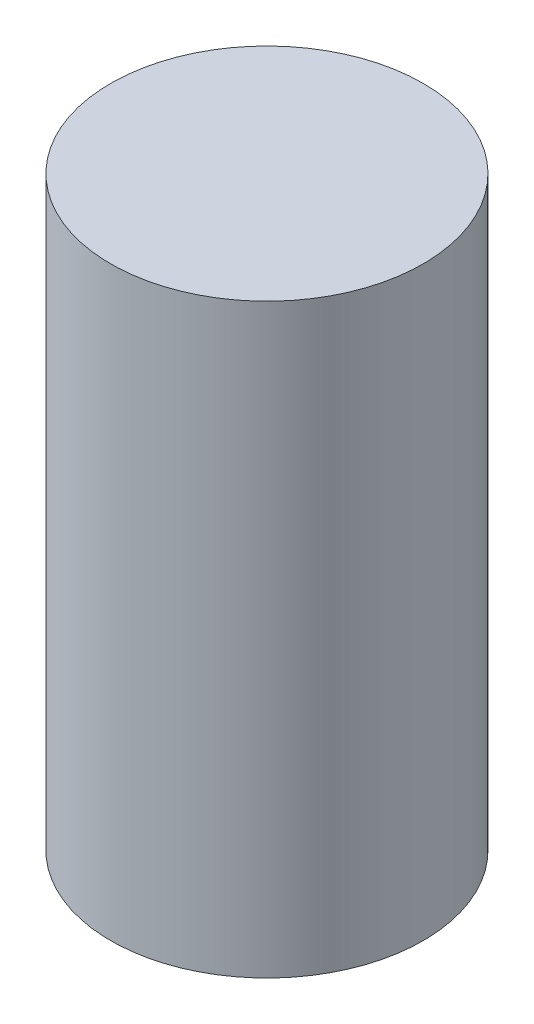
from build123d import *

# Parameters (mm, degrees)
SKETCH_1_R      = 48
EXTRUDE_1_DEPTH = 180


with BuildPart() as part:
    # Эскиз1 → Бобышка-Вытянуть1 (new body)
    with BuildSketch(Plane(origin=(0, 0, 0), x_dir=(1, 0, 0), z_dir=(0, 1, 0))):
        with Locations(Location((0, 0, 0), (0, 0, 90))):
            Circle(SKETCH_1_R)
    extrude(amount=EXTRUDE_1_DEPTH)


solid = part.part
